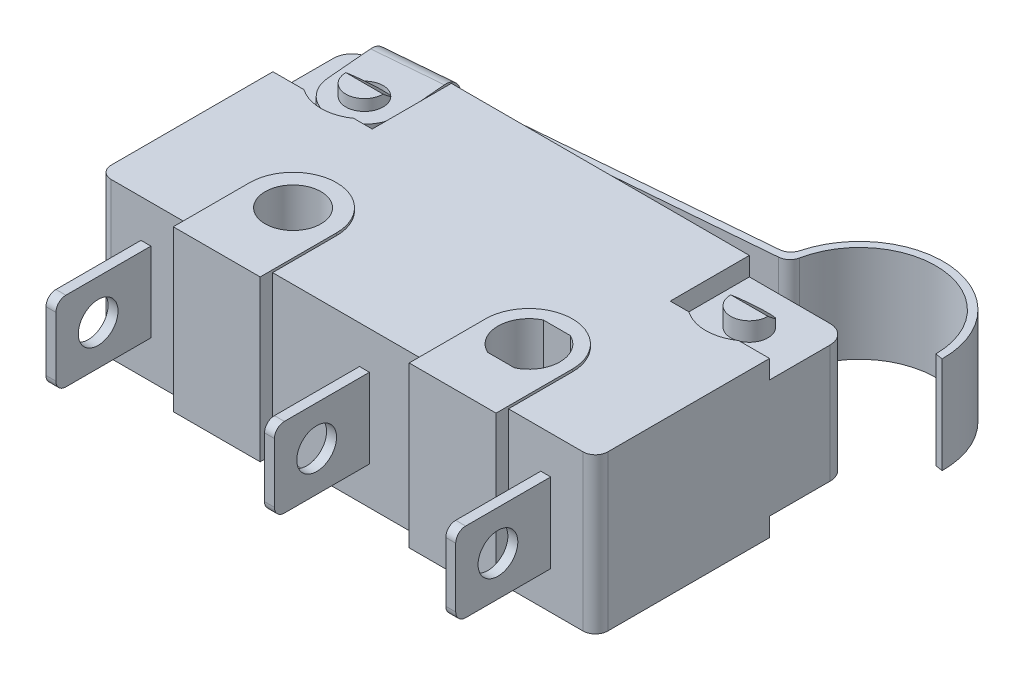
from build123d import *

# Parameters (mm, degrees)
SKETCH1_W               = 20
SKETCH1_H               = 10.2
BOSS_EXTRUDE1_DEPTH     = 6.25
FILLET1_R               = 0.75
FILLET2_R               = 0.5
SKETCH2_R               = 1.125
CUT_EXTRUDE1_DEPTH      = 13.848054327
BOSS_EXTRUDE2_START     = 0.1
SKETCH3_R               = 1.125
BOSS_EXTRUDE2_DEPTH     = 6.45
SKETCH4_R               = 0.75
CUT_EXTRUDE2_DEPTH      = 0.75
CUT_EXTRUDE3_START      = -5.5
SKETCH4_4_R             = 0.75
CUT_EXTRUDE3_DEPTH      = 0.75
CUT_EXTRUDE4_REACH      = 23.718
CUT_EXTRUDE5_START      = -16
CUT_EXTRUDE5_DEPTH      = 4
BOSS_EXTRUDE4_DEPTH     = 1.5
BOSS_EXTRUDE5_START     = 0.3
BOSS_EXTRUDE5_DEPTH     = 5.35
CUT_EXTRUDE6_DEPTH      = 19.834324064
CUT_EXTRUDE6_DEPTH_BACK = 19.834324064
CUT_EXTRUDE7_DEPTH      = 2.75
SKETCH10_W              = 0.4
SKETCH10_H              = 3.825
BOSS_EXTRUDE6_DEPTH     = 1.6
BOSS_EXTRUDE6_2_DEPTH   = 1.6
BOSS_EXTRUDE6_3_DEPTH   = 1.6
SKETCH11_R              = 0.8
CUT_EXTRUDE8_DEPTH      = 24.763279458


with BuildPart() as part:
    # Sketch1 → Boss-Extrude1 (new body)
    with BuildSketch(Plane(origin=(0, 0, 0), x_dir=(1, 0, 0), z_dir=(0, 1, 0))):
        Rectangle(SKETCH1_W, SKETCH1_H)
    extrude(amount=BOSS_EXTRUDE1_DEPTH)

    # Fillet1
    fillet1_edges = [part.edges().sort_by_distance(p)[0] for p in [
        (-10, 3.125, -5.1),
        (10, 3.125, -5.1),
    ]]
    fillet(fillet1_edges, radius=FILLET1_R)

    # Fillet2
    fillet2_edges = [part.edges().sort_by_distance(p)[0] for p in [
        (10, 3.125, 5.1),
        (-10, 3.125, 5.1),
    ]]
    fillet(fillet2_edges, radius=FILLET2_R)

    # Sketch2 → Cut-Extrude1 (cut, through all)
    with BuildSketch(Plane(origin=(0, 6.25, 0), x_dir=(1, 0, 0), z_dir=(0, 1, 0))):
        with Locations(Location((-4.75, -2.525, 0), (0, 0, 270))):
            Circle(SKETCH2_R)
        with BuildLine():
            Line((5.294862368, -1.4), (4.205137632, -1.4))
            ThreePointArc((4.205137632, -1.4), (3.5, -2.525), (4.205137632, -3.65))
            Line((4.205137632, -3.65), (5.294862368, -3.65))
            ThreePointArc((5.294862368, -3.65), (6, -2.525), (5.294862368, -1.4))
        make_face()
    extrude(amount=-CUT_EXTRUDE1_DEPTH, mode=Mode.SUBTRACT)

    # Sketch3 → Boss-Extrude2 (add)
    # profile 1 of 2: a face of its own
    with BuildSketch(Plane(origin=(0, 6.25, 0), x_dir=(1, 0, 0), z_dir=(0, 1, 0)).offset(BOSS_EXTRUDE2_START)):
        with BuildLine():
            Line((-6.5, -5.1), (-6.5, -2.525))
            ThreePointArc((-6.5, -2.525), (-4.75, -0.775), (-3, -2.525))
            Line((-3, -2.525), (-3, -5.1))
            Line((-3, -5.1), (-3, -5.6))
            Line((-3, -5.6), (-6.5, -5.6))
            Line((-6.5, -5.6), (-6.5, -5.1))
        make_face()
        with Locations(Location((-4.75, -2.525, 0), (0, 0, 270))):
            Circle(SKETCH3_R, mode=Mode.SUBTRACT)
    # profile 2 of 2: a face of its own
    with BuildSketch(Plane(origin=(0, 6.25, 0), x_dir=(1, 0, 0), z_dir=(0, 1, 0)).offset(BOSS_EXTRUDE2_START)):
        with BuildLine():
            Line((6.5, -5.6), (6.5, -5.1))
            Line((6.5, -5.1), (6.5, -2.525))
            ThreePointArc((6.5, -2.525), (4.75, -0.775), (3, -2.525))
            Line((3, -2.525), (3, -5.1))
            Line((3, -5.1), (3, -5.6))
            Line((3, -5.6), (6.5, -5.6))
        make_face()
        with BuildLine():
            Line((4.205137632, -3.65), (5.294862368, -3.65))
            ThreePointArc((5.294862368, -3.65), (6, -2.525), (5.294862368, -1.4))
            Line((5.294862368, -1.4), (4.205137632, -1.4))
            ThreePointArc((4.205137632, -1.4), (3.5, -2.525), (4.205137632, -3.65))
        make_face(mode=Mode.SUBTRACT)
    extrude(amount=-BOSS_EXTRUDE2_DEPTH)

    # Sketch4 → Cut-Extrude2 (cut)
    # profile 1 of 2: a face of its own
    with BuildSketch(Plane(origin=(0, 6.25, 0), x_dir=(1, 0, 0), z_dir=(0, 1, 0))):
        with BuildLine():
            Line((-6, 1.913859338), (-6, 5.1))
            Line((-6, 5.1), (-9.25, 5.1))
            ThreePointArc((-9.25, 5.1), (-9.780330086, 4.880330086), (-10, 4.35))
            Line((-10, 4.35), (-10, 1.913859338))
            Line((-10, 1.913859338), (-8.75, 1.913859338))
            ThreePointArc((-8.75, 1.913859338), (-7.75, 1.6), (-6.75, 1.913859338))
            Line((-6.75, 1.913859338), (-6, 1.913859338))
        make_face()
        with Locations(Location((-7.75, 3.35, 0), (0, 0, 270))):
            Circle(SKETCH4_R, mode=Mode.SUBTRACT)
    # profile 2 of 2: a face of its own
    with BuildSketch(Plane(origin=(0, 6.25, 0), x_dir=(1, 0, 0), z_dir=(0, 1, 0))):
        with BuildLine():
            Line((9.25, 5.1), (6, 5.1))
            Line((6, 5.1), (6, 1.913859338))
            Line((6, 1.913859338), (6.75, 1.913859338))
            ThreePointArc((6.75, 1.913859338), (7.75, 1.6), (8.75, 1.913859338))
            Line((8.75, 1.913859338), (10, 1.913859338))
            Line((10, 1.913859338), (10, 4.35))
            ThreePointArc((10, 4.35), (9.780330086, 4.880330086), (9.25, 5.1))
        make_face()
        with Locations(Location((7.75, 3.35, 0), (0, 0, 270))):
            Circle(SKETCH4_R, mode=Mode.SUBTRACT)
    extrude(amount=-CUT_EXTRUDE2_DEPTH, mode=Mode.SUBTRACT)

    # Sketch4<4> → Cut-Extrude3 (cut)
    # profile 1 of 2: a face of its own
    with BuildSketch(Plane(origin=(0, 6.25, 0), x_dir=(1, 0, 0), z_dir=(0, 1, 0)).offset(CUT_EXTRUDE3_START)):
        with BuildLine():
            Line((-6, 1.913859338), (-6, 5.1))
            Line((-6, 5.1), (-9.25, 5.1))
            ThreePointArc((-9.25, 5.1), (-9.780330086, 4.880330086), (-10, 4.35))
            Line((-10, 4.35), (-10, 1.913859338))
            Line((-10, 1.913859338), (-8.75, 1.913859338))
            ThreePointArc((-8.75, 1.913859338), (-7.75, 1.6), (-6.75, 1.913859338))
            Line((-6.75, 1.913859338), (-6, 1.913859338))
        make_face()
        with Locations(Location((-7.75, 3.35, 0), (0, 0, 270))):
            Circle(SKETCH4_4_R, mode=Mode.SUBTRACT)
    # profile 2 of 2: a face of its own
    with BuildSketch(Plane(origin=(0, 6.25, 0), x_dir=(1, 0, 0), z_dir=(0, 1, 0)).offset(CUT_EXTRUDE3_START)):
        with BuildLine():
            Line((9.25, 5.1), (6, 5.1))
            Line((6, 5.1), (6, 1.913859338))
            Line((6, 1.913859338), (6.75, 1.913859338))
            ThreePointArc((6.75, 1.913859338), (7.75, 1.6), (8.75, 1.913859338))
            Line((8.75, 1.913859338), (10, 1.913859338))
            Line((10, 1.913859338), (10, 4.35))
            ThreePointArc((10, 4.35), (9.780330086, 4.880330086), (9.25, 5.1))
        make_face()
        with Locations(Location((7.75, 3.35, 0), (0, 0, 270))):
            Circle(SKETCH4_4_R, mode=Mode.SUBTRACT)
    extrude(amount=-CUT_EXTRUDE3_DEPTH, mode=Mode.SUBTRACT)

    # Cut-Extrude4: up to this face of the body (flat: up to its plane)
    cut_extrude4_end = Plane(part.part.faces().sort_by_distance((-6, 5.875, -3.506929669))[0])
    # Sketch5 → Cut-Extrude4 (cut, up to the picked face)
    with BuildSketch(Plane.ZY.offset(10), mode=Mode.PRIVATE) as cut_extrude4_sk1:
        Polygon((-4.1, 6.25), (-4.1, 5.620675277), (-3.35, 6.25), align=None)
    cut_extrude4_tool1 = split(extrude(cut_extrude4_sk1.sketch, amount=-CUT_EXTRUDE4_REACH, mode=Mode.PRIVATE), bisect_by=cut_extrude4_end, keep=Keep.BOTH, mode=Mode.PRIVATE)
    cut_extrude4 = cut_extrude4_tool1.solids().sort_by(Axis((-10, 6.040225, -3.85), (1, 0, 0)))[0]
    add(cut_extrude4, mode=Mode.SUBTRACT)

    # Sketch5<2> → Cut-Extrude5 (cut)
    with BuildSketch(Plane.ZY.offset(10).offset(CUT_EXTRUDE5_START)):
        Polygon((-4.1, 6.25), (-4.1, 5.620675277), (-3.35, 6.25), align=None)
    cut_extrude5 = extrude(amount=-CUT_EXTRUDE5_DEPTH, mode=Mode.SUBTRACT)

    # Mirror2: Cut-Extrude4, Cut-Extrude5 across plane
    add(cut_extrude4.mirror(Plane(origin=(0, 3.125, 0), x_dir=(0, 0, 1), z_dir=(0, -1, 0))), mode=Mode.SUBTRACT)
    add(cut_extrude5.mirror(Plane(origin=(0, 3.125, 0), x_dir=(0, 0, 1), z_dir=(0, -1, 0))), mode=Mode.SUBTRACT)


with BuildPart() as body_2:
    # Sketch6 → Boss-Extrude4 (new, symmetric)
    with BuildSketch(Plane(origin=(0, 3.125, 0), x_dir=(-1, 0, 0), z_dir=(0, -1, 0))):
        with BuildLine():
            Line((2, 5.1), (3.6, 5.1))
            Line((3.6, 5.1), (3.6, 5.3))
            ThreePointArc((3.6, 5.3), (2.8, 6.1), (2, 5.3))
            Line((2, 5.3), (2, 5.1))
        make_face()
    extrude(amount=BOSS_EXTRUDE4_DEPTH, both=True)


with BuildPart() as body_3:
    # Sketch7 → Boss-Extrude5 (new body)
    with BuildSketch(Plane.XZ.offset(-0.75).offset(BOSS_EXTRUDE5_START)):
        with BuildLine():
            Line((5.477048297, -6.804381566), (-6.576261264, -5.782814703))
            Line((-6.576261264, -5.782814703), (-6.379912037, -3.466120511))
            ThreePointArc((-6.379912037, -3.466120511), (-7.633879489, -1.979912037), (-9.120087963, -3.233879489))
            Line((-9.120087963, -3.233879489), (-9.341772575, -5.849501964))
            Line((-9.341772575, -5.849501964), (5.234355633, -7.084887938))
            ThreePointArc((5.234355633, -7.084887938), (5.513814435, -7.200323583), (5.675636311, -7.455737541))
            ThreePointArc((5.675636311, -7.455737541), (9.396485674, -9.939920602), (12.313964123, -6.54813568))
            Line((12.313964123, -6.54813568), (12.014303961, -6.596029174))
            ThreePointArc((12.014303961, -6.596029174), (9.244686524, -9.655827614), (5.924959902, -7.203774924))
            ThreePointArc((5.924959902, -7.203774924), (5.767585822, -6.929408185), (5.477048297, -6.804381566))
        make_face()
        with BuildLine():
            ThreePointArc((-7, -3.35), (-7.75, -2.6), (-8.5, -3.35))
            ThreePointArc((-8.5, -3.35), (-7.75, -4.1), (-7, -3.35))
        make_face(mode=Mode.SUBTRACT)
    extrude(amount=-BOSS_EXTRUDE5_DEPTH)

    # Sketch8 → Cut-Extrude6 (cut, two sides: drawn at the far end of the back side and taken through both)
    with BuildSketch(Plane(origin=(-0.558858876, 0, -6.593889516), x_dir=(-0.9964276096196082, 0, 0.08445128055721847), z_dir=(-0.08445128055721847, 0, -0.9964276096196082)).offset(-CUT_EXTRUDE6_DEPTH_BACK)):
        Polygon((-6.032120879, 5.8), (6.064402185, 5.8), (6.064402185, 5.075), (-12.82297228, 5.075), (-13.32297228, 5.075), (-13.32297228, 5.8), (-12.82297228, 5.8), align=None)
        Polygon((-6.032120879, 0.45), (6.064402185, 0.45), (6.064402185, 1.175), (-12.82297228, 1.175), (-13.32297228, 1.175), (-13.32297228, 0.45), (-12.82297228, 0.45), align=None)
    extrude(amount=CUT_EXTRUDE6_DEPTH + CUT_EXTRUDE6_DEPTH_BACK, mode=Mode.SUBTRACT)

    # Sketch9 → Cut-Extrude7 (cut)
    with BuildSketch(Plane(origin=(-8.782913699, 0, 0.744387552), x_dir=(0.08445128055721829, 0, 0.9964276096196082), z_dir=(-0.9964276096196082, 0, 0.08445128055721829))):
        with BuildLine():
            Line((-6.617529917, 0.45), (-5.892529917, 0.45))
            ThreePointArc((-5.892529917, 0.45), (-6.405182333, 0.662347584), (-6.617529917, 1.175))
            Line((-6.617529917, 1.175), (-6.617529917, 0.45))
        make_face()
        with BuildLine():
            Line((-6.617529917, 5.8), (-5.892529917, 5.8))
            ThreePointArc((-5.892529917, 5.8), (-6.405182333, 5.587652416), (-6.617529917, 5.075))
            Line((-6.617529917, 5.075), (-6.617529917, 5.8))
        make_face()
        with BuildLine():
            Line((-6.317529917, 1.175), (-6.317529917, 5.075))
            ThreePointArc((-6.317529917, 5.075), (-6.193050299, 5.375520382), (-5.892529917, 5.5))
            Line((-5.892529917, 5.5), (-2.617529917, 5.5))
            Line((-2.617529917, 5.5), (-2.617529917, 0.75))
            Line((-2.617529917, 0.75), (-5.892529917, 0.75))
            ThreePointArc((-5.892529917, 0.75), (-6.193050299, 0.874479618), (-6.317529917, 1.175))
        make_face()
    extrude(amount=-CUT_EXTRUDE7_DEPTH, mode=Mode.SUBTRACT)


with BuildPart() as body_4:
    # Sketch10 → Boss-Extrude6 (new, symmetric)
    with BuildSketch(Plane(origin=(0, 3.125, 0), x_dir=(-1, 0, 0), z_dir=(0, -1, 0))):
        with Locations((-8, -7.0125)):
            Rectangle(SKETCH10_W, SKETCH10_H)
    extrude(amount=BOSS_EXTRUDE6_DEPTH, both=True)


with BuildPart() as body_5:
    # Sketch10 → Boss-Extrude6 2 (new, symmetric)
    with BuildSketch(Plane(origin=(0, 3.125, 0), x_dir=(-1, 0, 0), z_dir=(0, -1, 0))):
        with Locations((-0.7, -7.0125)):
            Rectangle(SKETCH10_W, SKETCH10_H)
    extrude(amount=BOSS_EXTRUDE6_2_DEPTH, both=True)


with BuildPart() as body_6:
    # Sketch10 → Boss-Extrude6 3 (new, symmetric)
    with BuildSketch(Plane(origin=(0, 3.125, 0), x_dir=(-1, 0, 0), z_dir=(0, -1, 0))):
        with Locations((8.1, -7.0125)):
            Rectangle(SKETCH10_W, SKETCH10_H)
    extrude(amount=BOSS_EXTRUDE6_3_DEPTH, both=True)


with BuildPart() as cut_extrude8_tool:
    # Sketch11 → Cut-Extrude8 (new, through all)
    with BuildSketch(Plane.ZY.offset(8.3)):
        with Locations((7.225, 3.125)):
            Circle(SKETCH11_R)
        with BuildLine():
            Line((8.925, 4.725), (8.925, 4.325))
            ThreePointArc((8.925, 4.325), (8.807842712, 4.607842712), (8.525, 4.725))
            Line((8.525, 4.725), (8.925, 4.725))
        make_face()
        with BuildLine():
            Line((8.925, 1.525), (8.525, 1.525))
            ThreePointArc((8.525, 1.525), (8.807842712, 1.642157288), (8.925, 1.925))
            Line((8.925, 1.925), (8.925, 1.525))
        make_face()
    extrude(amount=-CUT_EXTRUDE8_DEPTH)


with BuildPart() as body_4_1:
    add(body_4.part)

    # Cut-Extrude8: cut by cut_extrude8_tool
    add(cut_extrude8_tool.part, mode=Mode.SUBTRACT)


with BuildPart() as body_5_1:
    add(body_5.part)

    # Cut-Extrude8: cut by cut_extrude8_tool
    add(cut_extrude8_tool.part, mode=Mode.SUBTRACT)


with BuildPart() as body_6_1:
    add(body_6.part)

    # Cut-Extrude8: cut by cut_extrude8_tool
    add(cut_extrude8_tool.part, mode=Mode.SUBTRACT)


solid = Compound([part.part, body_2.part, body_3.part, body_4_1.part, body_5_1.part, body_6_1.part])
